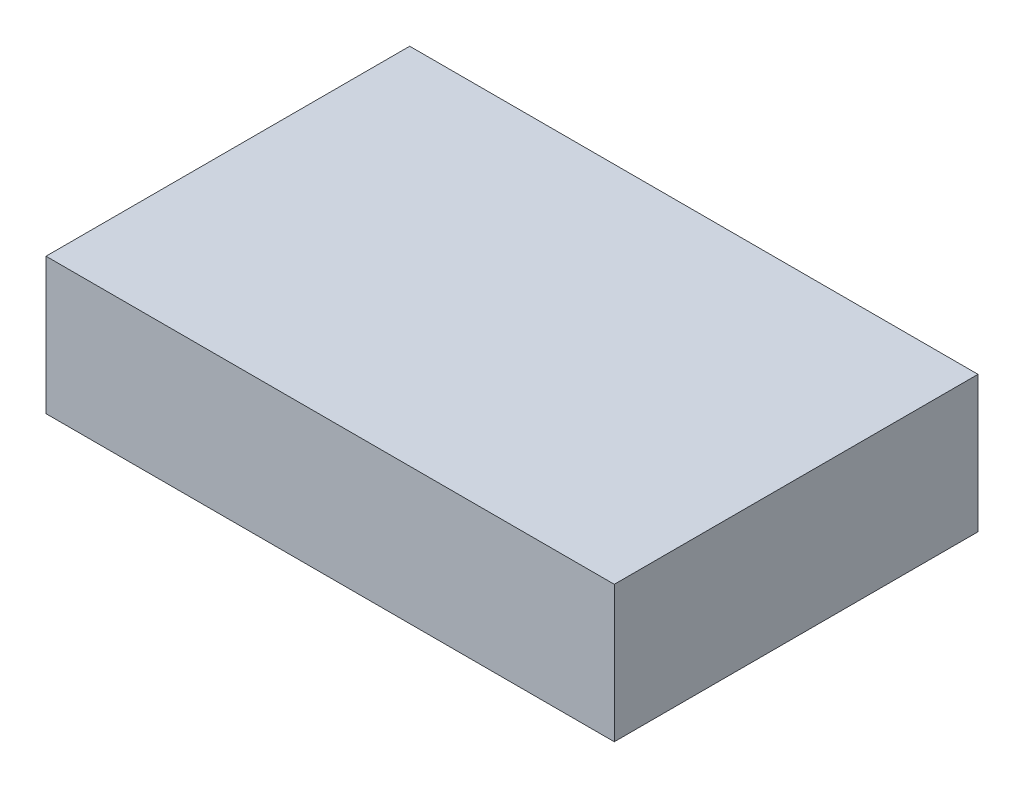
from build123d import *

# Parameters (mm, degrees)
SKETCH1_W           = 250
SKETCH1_H           = 160
BOSS_EXTRUDE1_DEPTH = 60


with BuildPart() as part:
    # Sketch1 → Boss-Extrude1 (new body)
    with BuildSketch(Plane(origin=(0, 0, 0), x_dir=(1, 0, 0), z_dir=(0, 1, 0))):
        Rectangle(SKETCH1_W, SKETCH1_H)
    extrude(amount=BOSS_EXTRUDE1_DEPTH)


solid = part.part
